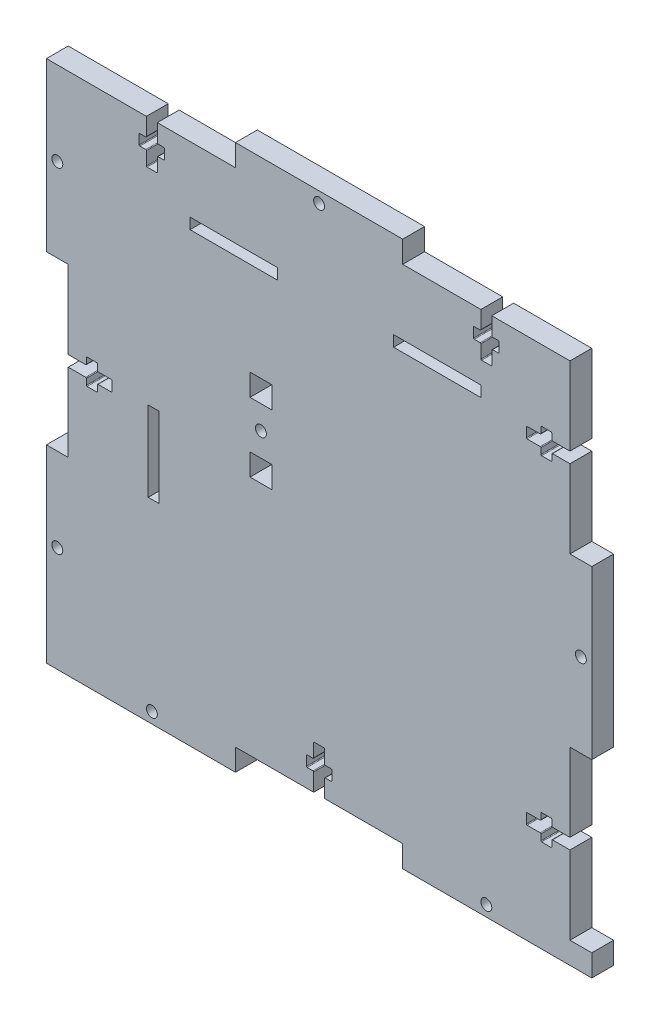
from build123d import *

# Parameters (mm, degrees)
BOX_SIDE_DEPTH       = 6
SKETCH2_R            = 1.5
SCREW_CUT_OUTS_DEPTH = 107.235587258
SKETCH3_R            = 1.5
SKETCH3_W            = 24
SKETCH3_H            = 3
SKETCH3_W_2          = 6
SKETCH3_H_2          = 6
SKETCH3_W_3          = 3
SKETCH3_H_3          = 22
GROOVES_DEPTH        = 107.235587258
SKETCH4_W            = 6
SKETCH4_H            = 6
BOSS_EXTRUDE1_DEPTH  = 6


with BuildPart() as part:
    # Sketch1 → Box Side (new body)
    with BuildSketch(Plane.XY):
        Polygon((-69, 69), (-23, 69), (-23, 75), (23, 75), (23, 69), (69, 69), (69, 23), (75, 23), (75, -23), (69, -23), (69, -69), (69, -75), (23, -75), (23, -69), (-23, -69), (-23, -75), (-69, -75), (-75, -75), (-75, -69), (-75, -23), (-69, -23), (-69, 23), (-75, 23), (-75, 69), align=None)
    extrude(amount=BOX_SIDE_DEPTH)

    # Sketch2 → Screw Cut-outs (cut, through all)
    with BuildSketch(Plane.XY.offset(6)):
        with Locations((0, 72)):
            Circle(SKETCH2_R)
        with Locations(Location((72, 0, 0), (0, 0, 180))):
            Circle(SKETCH2_R)
        with Locations((-46, -72)):
            Circle(SKETCH2_R)
        with Locations(Location((46, -72, 0), (0, 0, 180))):
            Circle(SKETCH2_R)
        with Locations((-72, 46)):
            Circle(SKETCH2_R)
        with Locations(Location((-72, -46, 0), (0, 0, 180))):
            Circle(SKETCH2_R)
        with BuildLine():
            Line((-44.5, 69), (-44.5, 64.2))
            ThreePointArc((-44.5, 64.2), (-44.441421356, 64.058578644), (-44.3, 64))
            Line((-44.3, 64), (-42.7, 64))
            ThreePointArc((-42.7, 64), (-42.558578644, 63.941421356), (-42.5, 63.8))
            Line((-42.5, 63.8), (-42.5, 61.2))
            ThreePointArc((-42.5, 61.2), (-42.558578644, 61.058578644), (-42.7, 61))
            Line((-42.7, 61), (-44.3, 61))
            ThreePointArc((-44.3, 61), (-44.441421356, 60.941421356), (-44.5, 60.8))
            Line((-44.5, 60.8), (-44.5, 57.2))
            ThreePointArc((-44.5, 57.2), (-44.558578644, 57.058578644), (-44.7, 57))
            Line((-44.7, 57), (-47.3, 57))
            ThreePointArc((-47.3, 57), (-47.441421356, 57.058578644), (-47.5, 57.2))
            Line((-47.5, 57.2), (-47.5, 60.8))
            ThreePointArc((-47.5, 60.8), (-47.558578644, 60.941421356), (-47.7, 61))
            Line((-47.7, 61), (-49.3, 61))
            ThreePointArc((-49.3, 61), (-49.441421356, 61.058578644), (-49.5, 61.2))
            Line((-49.5, 61.2), (-49.5, 63.8))
            ThreePointArc((-49.5, 63.8), (-49.441421356, 63.941421356), (-49.3, 64))
            Line((-49.3, 64), (-47.7, 64))
            ThreePointArc((-47.7, 64), (-47.558578644, 64.058578644), (-47.5, 64.2))
            Line((-47.5, 64.2), (-47.5, 69))
            Line((-47.5, 69), (-44.5, 69))
        make_face()
        with BuildLine():
            Line((47.5, 69), (47.5, 64.2))
            ThreePointArc((47.5, 64.2), (47.558578644, 64.058578644), (47.7, 64))
            Line((47.7, 64), (49.3, 64))
            ThreePointArc((49.3, 64), (49.441421356, 63.941421356), (49.5, 63.8))
            Line((49.5, 63.8), (49.5, 61.2))
            ThreePointArc((49.5, 61.2), (49.441421356, 61.058578644), (49.3, 61))
            Line((49.3, 61), (47.7, 61))
            ThreePointArc((47.7, 61), (47.558578644, 60.941421356), (47.5, 60.8))
            Line((47.5, 60.8), (47.5, 57.2))
            ThreePointArc((47.5, 57.2), (47.441421356, 57.058578644), (47.3, 57))
            Line((47.3, 57), (44.7, 57))
            ThreePointArc((44.7, 57), (44.558578644, 57.058578644), (44.5, 57.2))
            Line((44.5, 57.2), (44.5, 60.8))
            ThreePointArc((44.5, 60.8), (44.441421356, 60.941421356), (44.3, 61))
            Line((44.3, 61), (42.7, 61))
            ThreePointArc((42.7, 61), (42.558578644, 61.058578644), (42.5, 61.2))
            Line((42.5, 61.2), (42.5, 63.8))
            ThreePointArc((42.5, 63.8), (42.558578644, 63.941421356), (42.7, 64))
            Line((42.7, 64), (44.3, 64))
            ThreePointArc((44.3, 64), (44.441421356, 64.058578644), (44.5, 64.2))
            Line((44.5, 64.2), (44.5, 69))
            Line((44.5, 69), (47.5, 69))
        make_face()
        with BuildLine():
            Line((69, 44.5), (64.2, 44.5))
            ThreePointArc((64.2, 44.5), (64.058578644, 44.441421356), (64, 44.3))
            Line((64, 44.3), (64, 42.7))
            ThreePointArc((64, 42.7), (63.941421356, 42.558578644), (63.8, 42.5))
            Line((63.8, 42.5), (61.2, 42.5))
            ThreePointArc((61.2, 42.5), (61.058578644, 42.558578644), (61, 42.7))
            Line((61, 42.7), (61, 44.3))
            ThreePointArc((61, 44.3), (60.941421356, 44.441421356), (60.8, 44.5))
            Line((60.8, 44.5), (57.2, 44.5))
            ThreePointArc((57.2, 44.5), (57.058578644, 44.558578644), (57, 44.7))
            Line((57, 44.7), (57, 47.3))
            ThreePointArc((57, 47.3), (57.058578644, 47.441421356), (57.2, 47.5))
            Line((57.2, 47.5), (60.8, 47.5))
            ThreePointArc((60.8, 47.5), (60.941421356, 47.558578644), (61, 47.7))
            Line((61, 47.7), (61, 49.3))
            ThreePointArc((61, 49.3), (61.058578644, 49.441421356), (61.2, 49.5))
            Line((61.2, 49.5), (63.8, 49.5))
            ThreePointArc((63.8, 49.5), (63.941421356, 49.441421356), (64, 49.3))
            Line((64, 49.3), (64, 47.7))
            ThreePointArc((64, 47.7), (64.058578644, 47.558578644), (64.2, 47.5))
            Line((64.2, 47.5), (69, 47.5))
            Line((69, 47.5), (69, 44.5))
        make_face()
        with BuildLine():
            Line((69, -47.5), (64.2, -47.5))
            ThreePointArc((64.2, -47.5), (64.058578644, -47.558578644), (64, -47.7))
            Line((64, -47.7), (64, -49.3))
            ThreePointArc((64, -49.3), (63.941421356, -49.441421356), (63.8, -49.5))
            Line((63.8, -49.5), (61.2, -49.5))
            ThreePointArc((61.2, -49.5), (61.058578644, -49.441421356), (61, -49.3))
            Line((61, -49.3), (61, -47.7))
            ThreePointArc((61, -47.7), (60.941421356, -47.558578644), (60.8, -47.5))
            Line((60.8, -47.5), (57.2, -47.5))
            ThreePointArc((57.2, -47.5), (57.058578644, -47.441421356), (57, -47.3))
            Line((57, -47.3), (57, -44.7))
            ThreePointArc((57, -44.7), (57.058578644, -44.558578644), (57.2, -44.5))
            Line((57.2, -44.5), (60.8, -44.5))
            ThreePointArc((60.8, -44.5), (60.941421356, -44.441421356), (61, -44.3))
            Line((61, -44.3), (61, -42.7))
            ThreePointArc((61, -42.7), (61.058578644, -42.558578644), (61.2, -42.5))
            Line((61.2, -42.5), (63.8, -42.5))
            ThreePointArc((63.8, -42.5), (63.941421356, -42.558578644), (64, -42.7))
            Line((64, -42.7), (64, -44.3))
            ThreePointArc((64, -44.3), (64.058578644, -44.441421356), (64.2, -44.5))
            Line((64.2, -44.5), (69, -44.5))
            Line((69, -44.5), (69, -47.5))
        make_face()
        with BuildLine():
            Line((-1.5, -69), (1.5, -69))
            Line((1.5, -69), (1.5, -64.2))
            ThreePointArc((1.5, -64.2), (1.558578644, -64.058578644), (1.7, -64))
            Line((1.7, -64), (3.3, -64))
            ThreePointArc((3.3, -64), (3.441421356, -63.941421356), (3.5, -63.8))
            Line((3.5, -63.8), (3.5, -61.2))
            ThreePointArc((3.5, -61.2), (3.441421356, -61.058578644), (3.3, -61))
            Line((3.3, -61), (1.7, -61))
            ThreePointArc((1.7, -61), (1.558578644, -60.941421356), (1.5, -60.8))
            Line((1.5, -60.8), (1.5, -57.2))
            ThreePointArc((1.5, -57.2), (1.441421356, -57.058578644), (1.3, -57))
            Line((1.3, -57), (-1.3, -57))
            ThreePointArc((-1.3, -57), (-1.441421356, -57.058578644), (-1.5, -57.2))
            Line((-1.5, -57.2), (-1.5, -60.8))
            ThreePointArc((-1.5, -60.8), (-1.558578644, -60.941421356), (-1.7, -61))
            Line((-1.7, -61), (-3.3, -61))
            ThreePointArc((-3.3, -61), (-3.441421356, -61.058578644), (-3.5, -61.2))
            Line((-3.5, -61.2), (-3.5, -63.8))
            ThreePointArc((-3.5, -63.8), (-3.441421356, -63.941421356), (-3.3, -64))
            Line((-3.3, -64), (-1.7, -64))
            ThreePointArc((-1.7, -64), (-1.558578644, -64.058578644), (-1.5, -64.2))
            Line((-1.5, -64.2), (-1.5, -69))
        make_face()
        with BuildLine():
            Line((-69, -1.5), (-64.2, -1.5))
            ThreePointArc((-64.2, -1.5), (-64.058578644, -1.558578644), (-64, -1.7))
            Line((-64, -1.7), (-64, -3.3))
            ThreePointArc((-64, -3.3), (-63.941421356, -3.441421356), (-63.8, -3.5))
            Line((-63.8, -3.5), (-61.2, -3.5))
            ThreePointArc((-61.2, -3.5), (-61.058578644, -3.441421356), (-61, -3.3))
            Line((-61, -3.3), (-61, -1.7))
            ThreePointArc((-61, -1.7), (-60.941421356, -1.558578644), (-60.8, -1.5))
            Line((-60.8, -1.5), (-57.2, -1.5))
            ThreePointArc((-57.2, -1.5), (-57.058578644, -1.441421356), (-57, -1.3))
            Line((-57, -1.3), (-57, 1.3))
            ThreePointArc((-57, 1.3), (-57.058578644, 1.441421356), (-57.2, 1.5))
            Line((-57.2, 1.5), (-60.8, 1.5))
            ThreePointArc((-60.8, 1.5), (-60.941421356, 1.558578644), (-61, 1.7))
            Line((-61, 1.7), (-61, 3.3))
            ThreePointArc((-61, 3.3), (-61.058578644, 3.441421356), (-61.2, 3.5))
            Line((-61.2, 3.5), (-63.8, 3.5))
            ThreePointArc((-63.8, 3.5), (-63.941421356, 3.441421356), (-64, 3.3))
            Line((-64, 3.3), (-64, 1.7))
            ThreePointArc((-64, 1.7), (-64.058578644, 1.558578644), (-64.2, 1.5))
            Line((-64.2, 1.5), (-69, 1.5))
            Line((-69, 1.5), (-69, -1.5))
        make_face()
    extrude(amount=-SCREW_CUT_OUTS_DEPTH, mode=Mode.SUBTRACT)

    # Sketch3 → Grooves (cut, through all)
    with BuildSketch(Plane.XY.offset(6)):
        with Locations((-16, 9.82)):
            Circle(SKETCH3_R)
        with Locations((32.5, 49.5)):
            Rectangle(SKETCH3_W, SKETCH3_H)
        with Locations((-16, 19.32)):
            Rectangle(SKETCH3_W_2, SKETCH3_H_2)
        with Locations((-16, 0.32)):
            Rectangle(SKETCH3_W_2, SKETCH3_H_2)
        with Locations((-23.5, 49.5)):
            Rectangle(SKETCH3_W, SKETCH3_H)
        with Locations((-45.5, -10.5)):
            Rectangle(SKETCH3_W_3, SKETCH3_H_3)
    extrude(amount=-GROOVES_DEPTH, mode=Mode.SUBTRACT)

    # Sketch4 → Boss-Extrude1 (add)
    with BuildSketch(Plane(origin=(0, 0, 0), x_dir=(-1, 0, 0), z_dir=(0, 0, -1))):
        with Locations((-72, -72)):
            Rectangle(SKETCH4_W, SKETCH4_H)
    extrude(amount=-BOSS_EXTRUDE1_DEPTH)


solid = part.part
